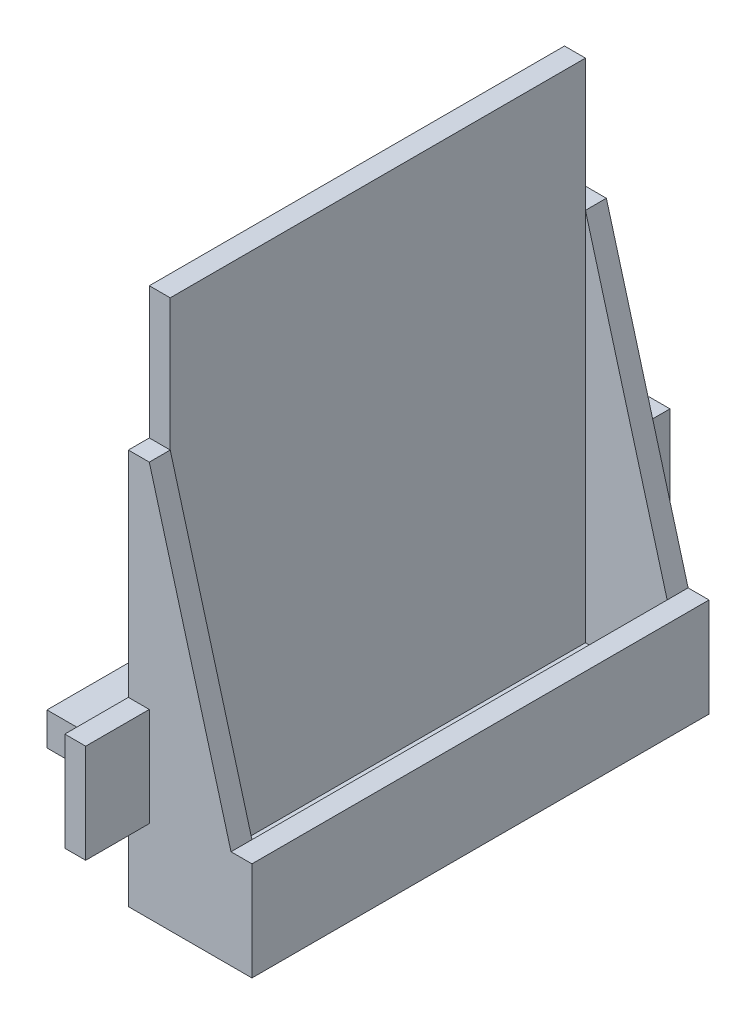
from build123d import *

# Parameters (mm, degrees)
SKETCH2_W           = 15
SKETCH2_H           = 5
BOSS_EXTRUDE1_DEPTH = 4.7625
BOSS_EXTRUDE3_DEPTH = 3.175
BOSS_EXTRUDE5_DEPTH = 15.575
SKETCH7_W           = 69.35
SKETCH7_H           = 15
BOSS_EXTRUDE6_DEPTH = 3.175
SKETCH8_W           = 3.1
SKETCH8_H           = 22.1
CUT_EXTRUDE1_DEPTH  = 3.175
CUT_EXTRUDE2_DEPTH  = 102.950172419


with BuildPart() as part:
    # Sketch2 → Boss-Extrude1 (new, symmetric)
    with BuildSketch(Plane(origin=(0, 0, 0), x_dir=(0, 0, -1), z_dir=(1, 0, 0))):
        with Locations((-30, 0)):
            Rectangle(SKETCH2_W, SKETCH2_H)
    extrude(amount=BOSS_EXTRUDE1_DEPTH, both=True)


with BuildPart() as body_2:
    # Mirror4: mirrored copy
    add(part.part.mirror(Plane.XY))


with BuildPart() as body_3:
    # Sketch4 → Boss-Extrude3 (new body)
    with BuildSketch(Plane(origin=(4.7625, 0, 0), x_dir=(0, 0, -1), z_dir=(1, 0, 0))):
        Polygon((31.515269753, 7.508745797), (44.325, 7.5), (44.325, -7.5), (31.5, -7.5), (31.5, -20), (-31.5, -20), (-31.5, -7.5), (-44.325, -7.5), (-44.325, 7.5), (-31.5, 7.5), (-31.5, 60), (31.5, 60), (31.5, 7.5), align=None)
    extrude(amount=BOSS_EXTRUDE3_DEPTH)


with BuildPart() as part_1:
    add(part.part)

    # Sketch6 → Boss-Extrude5 (add)
    with BuildSketch(Plane(origin=(4.7625, 0, 0), x_dir=(0, 0, -1), z_dir=(1, 0, 0))):
        Polygon((-31.5, 40), (-31.5, -16.825), (31.5, -16.825), (31.5, 40), (34.675, 40), (34.675, -20), (-34.675, -20), (-34.675, 40), align=None)
    extrude(amount=BOSS_EXTRUDE5_DEPTH)

    # Sketch7 → Boss-Extrude6 (add)
    with BuildSketch(Plane(origin=(20.3375, 0, 0), x_dir=(0, 0, -1), z_dir=(1, 0, 0))):
        with Locations((0, -12.5)):
            Rectangle(SKETCH7_W, SKETCH7_H)
    extrude(amount=BOSS_EXTRUDE6_DEPTH)

    # Sketch8 → Cut-Extrude1 (cut)
    with BuildSketch(Plane(origin=(0, -16.825, 0), x_dir=(1, 0, 0), z_dir=(0, 1, 0))):
        with Locations((14.0875, 0)):
            Rectangle(SKETCH8_W, SKETCH8_H)
    extrude(amount=-CUT_EXTRUDE1_DEPTH, mode=Mode.SUBTRACT)

    # Sketch10 → Cut-Extrude2 (cut, through all)
    with BuildSketch(Plane.XY.offset(34.675)):
        Polygon((7.9375, 40), (20.3375, -5), (20.3375, 40), align=None)
    extrude(amount=-CUT_EXTRUDE2_DEPTH, mode=Mode.SUBTRACT)


solid = Compound([body_2.part, body_3.part, part_1.part])
